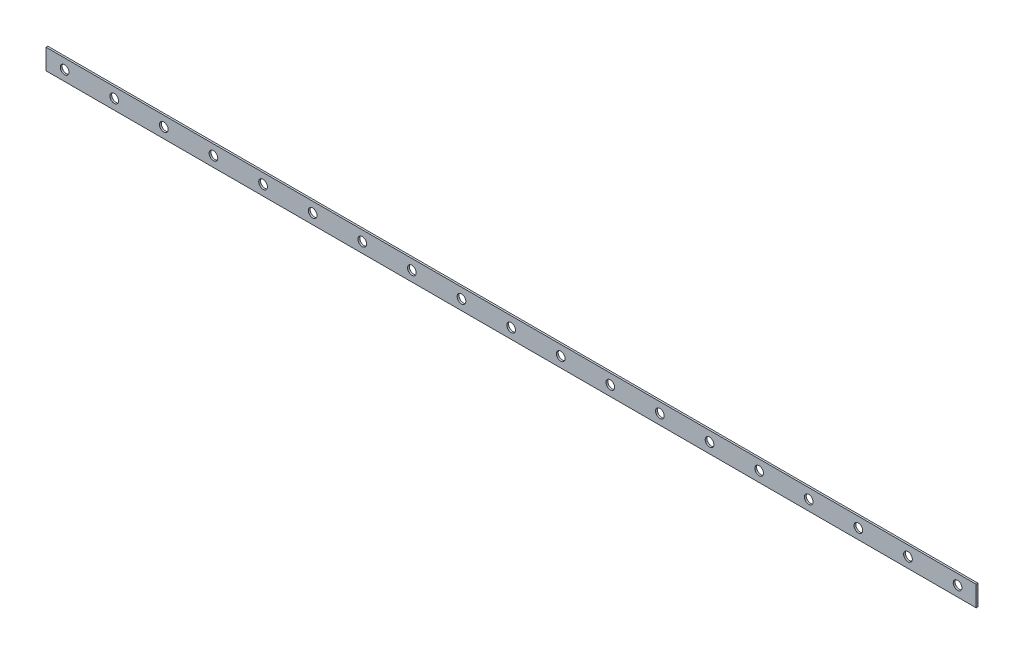
from build123d import *

# Parameters (mm, degrees)
SKETCH1_W               = 1500
SKETCH1_H               = 33
BOSS_EXTRUDE1_DEPTH     = 2.95
CUT_EXTRUDE1_DEPTH      = 1501.365856216
CUT_EXTRUDE1_DEPTH_BACK = 1501.365856216


with BuildPart() as part:
    # Sketch1 → Boss-Extrude1 (new body)
    with BuildSketch(Plane.XY):
        with Locations((750, 16.5)):
            Rectangle(SKETCH1_W, SKETCH1_H)
    extrude(amount=BOSS_EXTRUDE1_DEPTH)

    # Sketch3 → Cut-Extrude1 (cut, two sides: drawn at the far end of the back side and taken through both)
    with BuildSketch(Plane.XY.offset(-CUT_EXTRUDE1_DEPTH_BACK)):
        with BuildLine():
            ThreePointArc((270, 23.5), (263, 16.5), (270, 9.5))
            ThreePointArc((270, 9.5), (277, 16.5), (270, 23.5))
        make_face()
        with BuildLine():
            ThreePointArc((350, 23.5), (343, 16.5), (350, 9.5))
            ThreePointArc((350, 9.5), (357, 16.5), (350, 23.5))
        make_face()
        with BuildLine():
            ThreePointArc((430, 9.5), (437, 16.5), (430, 23.5))
            ThreePointArc((430, 23.5), (423, 16.5), (430, 9.5))
        make_face()
        with BuildLine():
            ThreePointArc((510, 9.5), (517, 16.5), (510, 23.5))
            ThreePointArc((510, 23.5), (503, 16.5), (510, 9.5))
        make_face()
        with BuildLine():
            ThreePointArc((590, 9.5), (597, 16.5), (590, 23.5))
            ThreePointArc((590, 23.5), (583, 16.5), (590, 9.5))
        make_face()
        with BuildLine():
            ThreePointArc((670, 23.5), (663, 16.5), (670, 9.5))
            ThreePointArc((670, 9.5), (677, 16.5), (670, 23.5))
        make_face()
        with BuildLine():
            ThreePointArc((750, 9.5), (757, 16.5), (750, 23.5))
            ThreePointArc((750, 23.5), (743, 16.5), (750, 9.5))
        make_face()
        with BuildLine():
            ThreePointArc((830, 9.5), (837, 16.5), (830, 23.5))
            ThreePointArc((830, 23.5), (823, 16.5), (830, 9.5))
        make_face()
        with BuildLine():
            ThreePointArc((910, 9.5), (917, 16.5), (910, 23.5))
            ThreePointArc((910, 23.5), (903, 16.5), (910, 9.5))
        make_face()
        with BuildLine():
            ThreePointArc((990, 9.5), (997, 16.5), (990, 23.5))
            ThreePointArc((990, 23.5), (983, 16.5), (990, 9.5))
        make_face()
        with BuildLine():
            ThreePointArc((1070, 9.5), (1077, 16.5), (1070, 23.5))
            ThreePointArc((1070, 23.5), (1063, 16.5), (1070, 9.5))
        make_face()
        with BuildLine():
            ThreePointArc((1150, 9.5), (1157, 16.5), (1150, 23.5))
            ThreePointArc((1150, 23.5), (1143, 16.5), (1150, 9.5))
        make_face()
        with BuildLine():
            ThreePointArc((1230, 9.5), (1237, 16.5), (1230, 23.5))
            ThreePointArc((1230, 23.5), (1223, 16.5), (1230, 9.5))
        make_face()
        with BuildLine():
            ThreePointArc((1310, 9.5), (1317, 16.5), (1310, 23.5))
            ThreePointArc((1310, 23.5), (1303, 16.5), (1310, 9.5))
        make_face()
        with BuildLine():
            ThreePointArc((1390, 9.5), (1397, 16.5), (1390, 23.5))
            ThreePointArc((1390, 23.5), (1383, 16.5), (1390, 9.5))
        make_face()
        with BuildLine():
            ThreePointArc((1470, 9.5), (1477, 16.5), (1470, 23.5))
            ThreePointArc((1470, 23.5), (1463, 16.5), (1470, 9.5))
        make_face()
        with BuildLine():
            ThreePointArc((30, 9.5), (37, 16.5), (30, 23.5))
            ThreePointArc((30, 23.5), (23, 16.5), (30, 9.5))
        make_face()
        with BuildLine():
            ThreePointArc((110, 9.5), (117, 16.5), (110, 23.5))
            ThreePointArc((110, 23.5), (103, 16.5), (110, 9.5))
        make_face()
        with BuildLine():
            ThreePointArc((190, 9.5), (197, 16.5), (190, 23.5))
            ThreePointArc((190, 23.5), (183, 16.5), (190, 9.5))
        make_face()
    extrude(amount=CUT_EXTRUDE1_DEPTH + CUT_EXTRUDE1_DEPTH_BACK, mode=Mode.SUBTRACT)


solid = part.part
